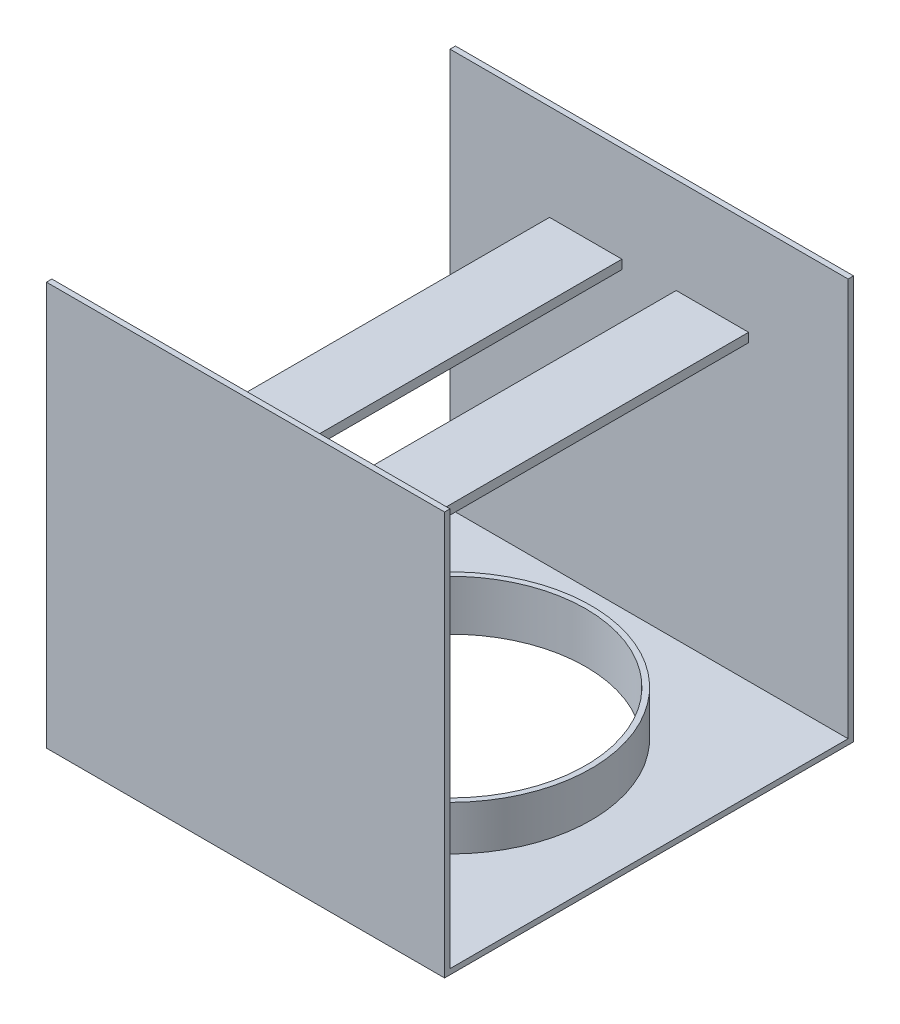
from build123d import *

# Parameters (mm, degrees)
SKETCH_1_W                  = 220
SKETCH_1_H                  = 220
EXTRUDE_2_DEPTH             = 220
SKETCH_3_R                  = 78
CUT_EXTRUDE_1_DEPTH         = 240
SHELL_2_T                   = 3
SKETCH_5_W                  = 207.122367347
SKETCH_5_H                  = 195.284428571
CUT_EXTRUDE_3_DEPTH         = 180
SKETCH_12_W                 = 226
SKETCH_12_H                 = 223
CUT_EXTRUDE_6_DEPTH         = 3
SKETCH_13_W                 = 226
SKETCH_13_H                 = 223
CUT_EXTRUDE_7_DEPTH         = 3
EXTRUDE_6_REACH             = 272.682
SKETCH_16_W                 = 40
SKETCH_16_H                 = 5
EXTRUDE_6_DIRECTION_2_REACH = 272.682


with BuildPart() as part:
    # 草图1 → 凸台-拉伸2 (new body)
    with BuildSketch(Plane(origin=(0, 0, 0), x_dir=(1, 0, 0), z_dir=(0, 1, 0))):
        Rectangle(SKETCH_1_W, SKETCH_1_H)
    extrude(amount=EXTRUDE_2_DEPTH)

    # 草图3 → 切除-拉伸1 (cut)
    with BuildSketch(Plane(origin=(0, 0, 0), x_dir=(1, 0, 0), z_dir=(0, 1, 0))):
        with Locations(Location((0, 0, 0), (0, 0, 270))):
            Circle(SKETCH_3_R)
    extrude(amount=CUT_EXTRUDE_1_DEPTH, mode=Mode.SUBTRACT)

    # 抽壳2
    shell_2_openings = [part.faces().sort_by_distance(p)[0] for p in [
        (0, 220, -106.888730163),
    ]]
    offset(amount=SHELL_2_T, openings=shell_2_openings, kind=Kind.INTERSECTION)

    # 草图5 → 切除-拉伸3 (cut)
    with BuildSketch(Plane.ZY.offset(-78)):
        with Locations((-1.991561224, 122.357785714)):
            Rectangle(SKETCH_5_W, SKETCH_5_H)
    extrude(amount=CUT_EXTRUDE_3_DEPTH, mode=Mode.SUBTRACT)

    # 草图12 → 切除-拉伸6 (cut)
    with BuildSketch(Plane(origin=(113, 0, 0), x_dir=(0, 0, -1), z_dir=(1, 0, 0))):
        with Locations((0, 108.5)):
            Rectangle(SKETCH_12_W, SKETCH_12_H)
    extrude(amount=-CUT_EXTRUDE_6_DEPTH, mode=Mode.SUBTRACT)

    # 草图13 → 切除-拉伸7 (cut)
    with BuildSketch(Plane.ZY.offset(113)):
        with Locations((0, 108.5)):
            Rectangle(SKETCH_13_W, SKETCH_13_H)
    extrude(amount=-CUT_EXTRUDE_7_DEPTH, mode=Mode.SUBTRACT)

    # 凸台-拉伸6: up to this face of the body (flat: up to its plane)
    extrude_6_end = Plane(part.part.faces().sort_by_distance((0, 110, -110))[0])
    # 草图16 → 凸台-拉伸6 (add, up to the picked face)
    with BuildSketch(Plane.XY, mode=Mode.PRIVATE) as extrude_6_sk1:
        with Locations((-35, 164.5)):
            Rectangle(SKETCH_16_W, SKETCH_16_H)
    extrude_6_tool1 = split(extrude(extrude_6_sk1.sketch, amount=-EXTRUDE_6_REACH, mode=Mode.PRIVATE), bisect_by=extrude_6_end, keep=Keep.BOTH, mode=Mode.PRIVATE)
    # 草图16 → 凸台-拉伸6 (add, up to the picked face)
    with BuildSketch(Plane.XY, mode=Mode.PRIVATE) as extrude_6_sk2:
        with Locations((35, 164.5)):
            Rectangle(SKETCH_16_W, SKETCH_16_H)
    extrude_6_tool2 = split(extrude(extrude_6_sk2.sketch, amount=-EXTRUDE_6_REACH, mode=Mode.PRIVATE), bisect_by=extrude_6_end, keep=Keep.BOTH, mode=Mode.PRIVATE)
    add(extrude_6_tool1.solids().sort_by(Axis((-35, 164.5, 0), (0, 0, -1)))[0])
    add(extrude_6_tool2.solids().sort_by(Axis((35, 164.5, 0), (0, 0, -1)))[0])

    # 凸台-拉伸6 direction 2: up to this face of the body (flat: up to its plane)
    extrude_6_direction_2_end = Plane(part.part.faces().sort_by_distance((0, 110, 110))[0])
    # 草图16 → 凸台-拉伸6 direction 2 (add, up to the picked face)
    with BuildSketch(Plane.XY, mode=Mode.PRIVATE) as extrude_6_direction_2_sk1:
        with Locations((-35, 164.5)):
            Rectangle(SKETCH_16_W, SKETCH_16_H)
    extrude_6_direction_2_tool1 = split(extrude(extrude_6_direction_2_sk1.sketch, amount=EXTRUDE_6_DIRECTION_2_REACH, mode=Mode.PRIVATE), bisect_by=extrude_6_direction_2_end, keep=Keep.BOTH, mode=Mode.PRIVATE)
    # 草图16 → 凸台-拉伸6 direction 2 (add, up to the picked face)
    with BuildSketch(Plane.XY, mode=Mode.PRIVATE) as extrude_6_direction_2_sk2:
        with Locations((35, 164.5)):
            Rectangle(SKETCH_16_W, SKETCH_16_H)
    extrude_6_direction_2_tool2 = split(extrude(extrude_6_direction_2_sk2.sketch, amount=EXTRUDE_6_DIRECTION_2_REACH, mode=Mode.PRIVATE), bisect_by=extrude_6_direction_2_end, keep=Keep.BOTH, mode=Mode.PRIVATE)
    add(extrude_6_direction_2_tool1.solids().sort_by(Axis((-35, 164.5, 0), (0, 0, 1)))[0])
    add(extrude_6_direction_2_tool2.solids().sort_by(Axis((35, 164.5, 0), (0, 0, 1)))[0])


solid = part.part
